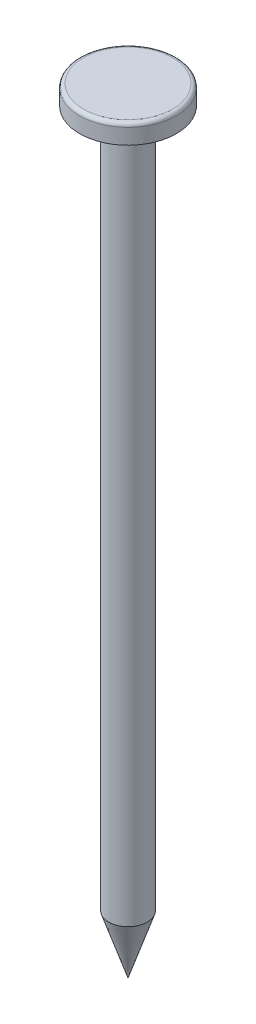
from build123d import *

# Parameters (mm, degrees)
FILETE1_R = 0.1


with BuildPart() as part:
    # Esboço2 → Revolução5 (revolve)
    with BuildSketch(Plane.XY, mode=Mode.PRIVATE) as revolu_o5_sk:
        Polygon((0, 0), (0, 20), (1.25, 20), (1.25, 19.5), (0.5, 19.5), (0.5, 1.5), align=None)
    revolve(revolu_o5_sk.sketch.rotate(Axis((0, -4.466059489, 0), (0, 1, 0)), 90), axis=Axis((0, -4.466059489, 0), (0, 1, 0)))

    # Filete1
    filete1_edges = [part.edges().sort_by_distance(p)[0] for p in [
        (0, 20, 1.25),
    ]]
    fillet(filete1_edges, radius=FILETE1_R)


solid = part.part
